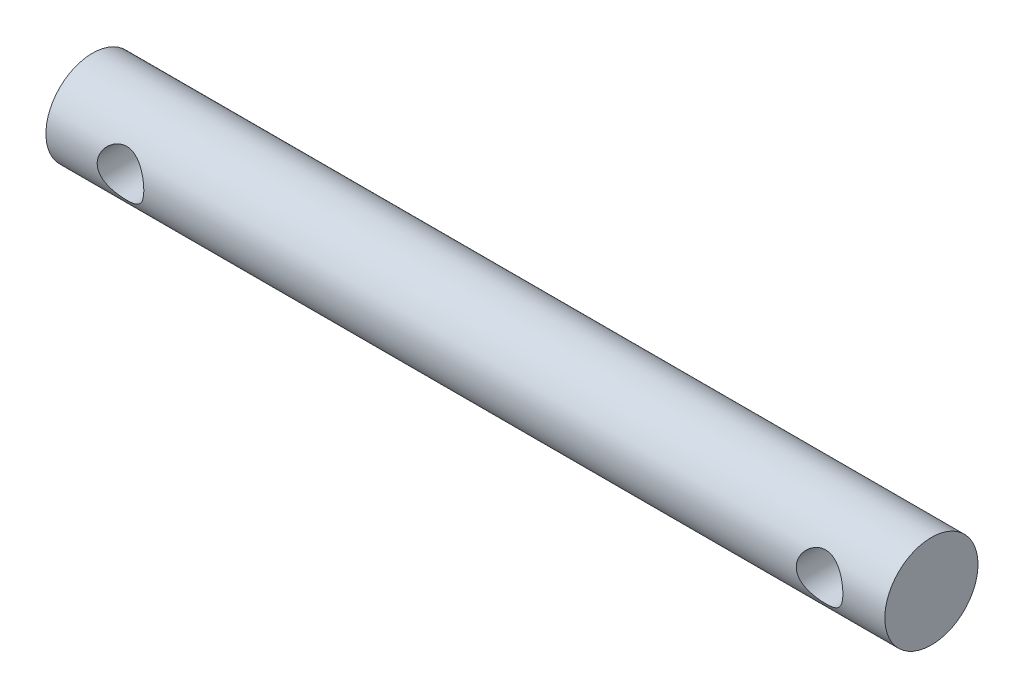
from build123d import *

# Parameters (mm, degrees)
SKETCH1_R               = 2.5
BOSS_EXTRUDE1_DEPTH     = 45
CUT_EXTRUDE1_DEPTH      = 46.138675213
CUT_EXTRUDE1_DEPTH_BACK = 46.138675213
SKETCH3_R               = 1.25


with BuildPart() as part:
    # Sketch1 → Boss-Extrude1 (new body)
    with BuildSketch(Plane(origin=(0, 0, 0), x_dir=(0, 0, -1), z_dir=(1, 0, 0))):
        Circle(SKETCH1_R)
    extrude(amount=-BOSS_EXTRUDE1_DEPTH)

    # Sketch3 → Cut-Extrude1 (cut, two sides: drawn at the far end of the back side and taken through both)
    with BuildSketch(Plane.XY.offset(-CUT_EXTRUDE1_DEPTH_BACK)):
        with Locations((-41, 0)):
            Circle(SKETCH3_R)
        with Locations((-3.5, 0)):
            Circle(SKETCH3_R)
    extrude(amount=CUT_EXTRUDE1_DEPTH + CUT_EXTRUDE1_DEPTH_BACK, mode=Mode.SUBTRACT)


solid = part.part
